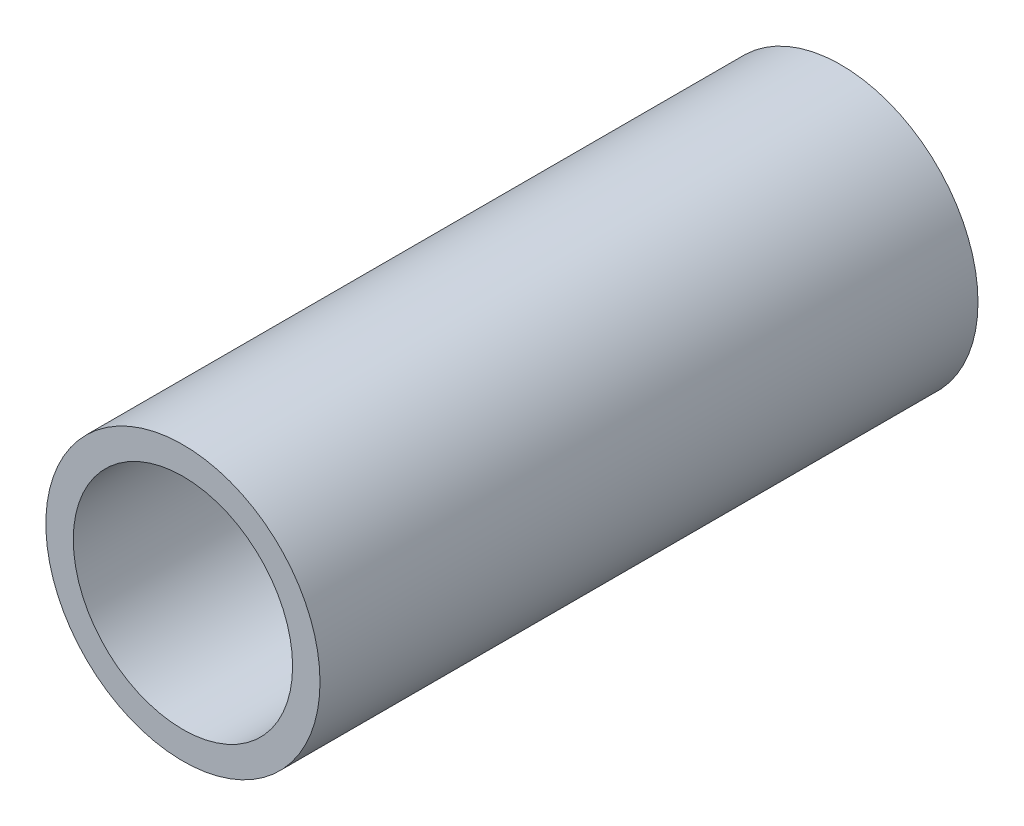
from build123d import *

# Parameters (mm, degrees)
SKETCH1_R           = 25
BOSS_EXTRUDE1_DEPTH = 120
SKETCH2_R           = 20
CUT_EXTRUDE1_DEPTH  = 126.099960032


with BuildPart() as part:
    # Sketch1 → Boss-Extrude1 (new body)
    with BuildSketch(Plane.XY):
        Circle(SKETCH1_R)
    extrude(amount=BOSS_EXTRUDE1_DEPTH)

    # Sketch2 → Cut-Extrude1 (cut, through all)
    with BuildSketch(Plane.XY.offset(120)):
        Circle(SKETCH2_R)
    extrude(amount=-CUT_EXTRUDE1_DEPTH, mode=Mode.SUBTRACT)


solid = part.part
